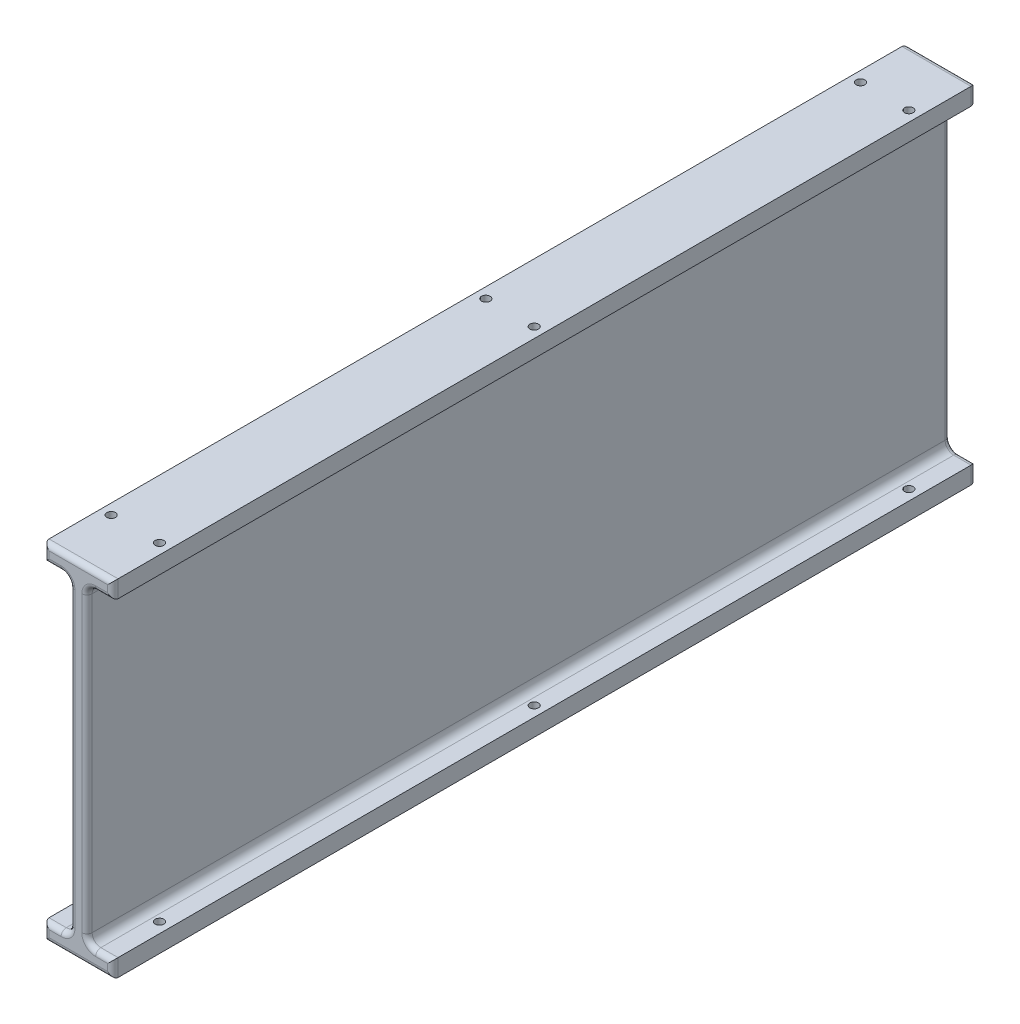
from build123d import *

# Parameters (mm, degrees)
BOSS_EXTRUDE1_DEPTH   = 250
FILLET1_R             = 3
F_5_0MM_DOWEL_HOLE1_D = 5


with BuildPart() as part:
    # Sketch2 → Boss-Extrude1 (new, symmetric)
    with BuildSketch(Plane.XY):
        with BuildLine():
            Line((5, 85), (5, -85))
            ThreePointArc((5, -85), (6.464466094, -88.535533906), (10, -90))
            Line((10, -90), (20, -90))
            Line((20, -90), (20, -100))
            Line((20, -100), (-20, -100))
            Line((-20, -100), (-20, -90))
            Line((-20, -90), (-10, -90))
            ThreePointArc((-10, -90), (-6.464466094, -88.535533906), (-5, -85))
            Line((-5, -85), (-5, 85))
            ThreePointArc((-5, 85), (-6.464466094, 88.535533906), (-10, 90))
            Line((-10, 90), (-20, 90))
            Line((-20, 90), (-20, 100))
            Line((-20, 100), (20, 100))
            Line((20, 100), (20, 90))
            Line((20, 90), (10, 90))
            ThreePointArc((10, 90), (6.464466094, 88.535533906), (5, 85))
        make_face()
    extrude(amount=BOSS_EXTRUDE1_DEPTH, both=True)

    # Fillet1
    fillet1_edges = [part.edges().sort_by_distance(p)[0] for p in [
        (-5, 0, 250),
        (-6.464466094, -88.535533906, 250),
        (-15, 90, -250),
        (-20, 95, -250),
        (0, 100, -250),
        (20, 95, -250),
        (15, 90, -250),
        (6.464466094, 88.535533906, -250),
        (-15, -90, 250),
        (5, 0, -250),
        (6.464466094, -88.535533906, -250),
        (15, -90, -250),
        (20, -95, -250),
        (0, -100, -250),
        (-20, -95, -250),
        (-15, -90, -250),
        (-6.464466094, -88.535533906, -250),
        (-5, 0, -250),
        (-6.464466094, 88.535533906, -250),
        (-20, -95, 250),
        (0, -100, 250),
        (20, -95, 250),
        (15, -90, 250),
        (6.464466094, -88.535533906, 250),
        (5, 0, 250),
        (6.464466094, 88.535533906, 250),
        (-6.464466094, 88.535533906, 250),
        (15, 90, 250),
        (20, 95, 250),
        (0, 100, 250),
        (-20, 95, 250),
        (-15, 90, 250),
    ]]
    fillet(fillet1_edges, radius=FILLET1_R)

    # Ø5.0mm Dowel Hole1 (through all)
    with Locations(Plane(origin=(0, 100, 0), x_dir=(1, 0, 0), z_dir=(0, 1, 0))):
        with Locations((14, 217), (-14, 217), (-14, -217), (14, -217), (-14, 0), (14, 0)):
            Hole(F_5_0MM_DOWEL_HOLE1_D / 2)


solid = part.part
